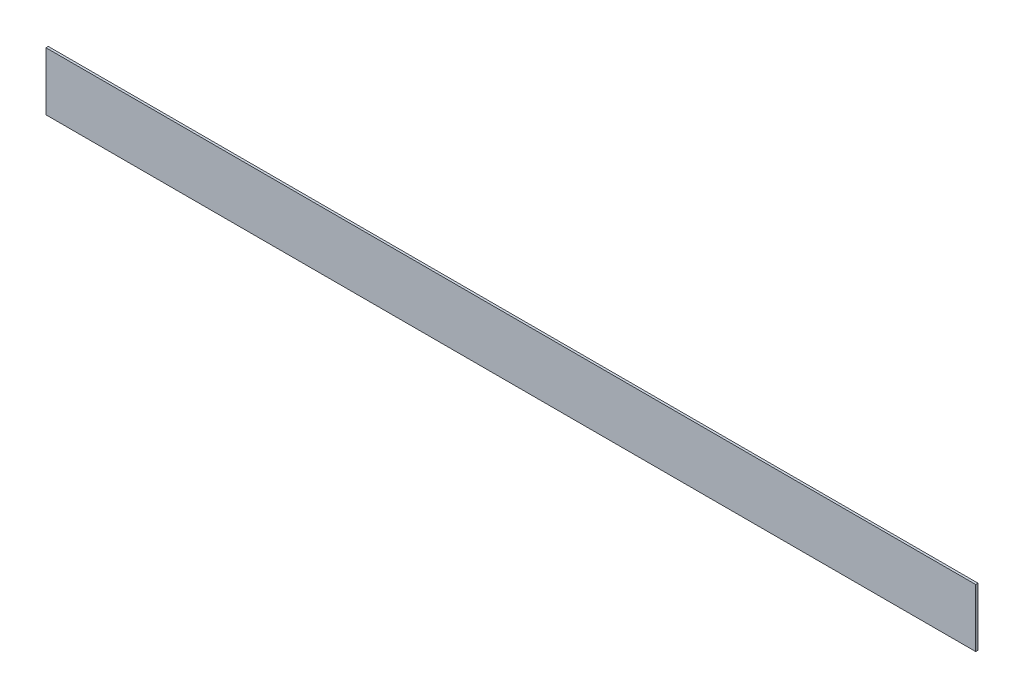
from build123d import *

# Parameters (mm, degrees)
SKETCH1_W           = 800
SKETCH1_H           = 50
BOSS_EXTRUDE1_DEPTH = 2


with BuildPart() as part:
    # Sketch1 → Boss-Extrude1 (new body)
    with BuildSketch(Plane.XY):
        with Locations((0, -1720)):
            Rectangle(SKETCH1_W, SKETCH1_H)
    extrude(amount=BOSS_EXTRUDE1_DEPTH)


solid = part.part
